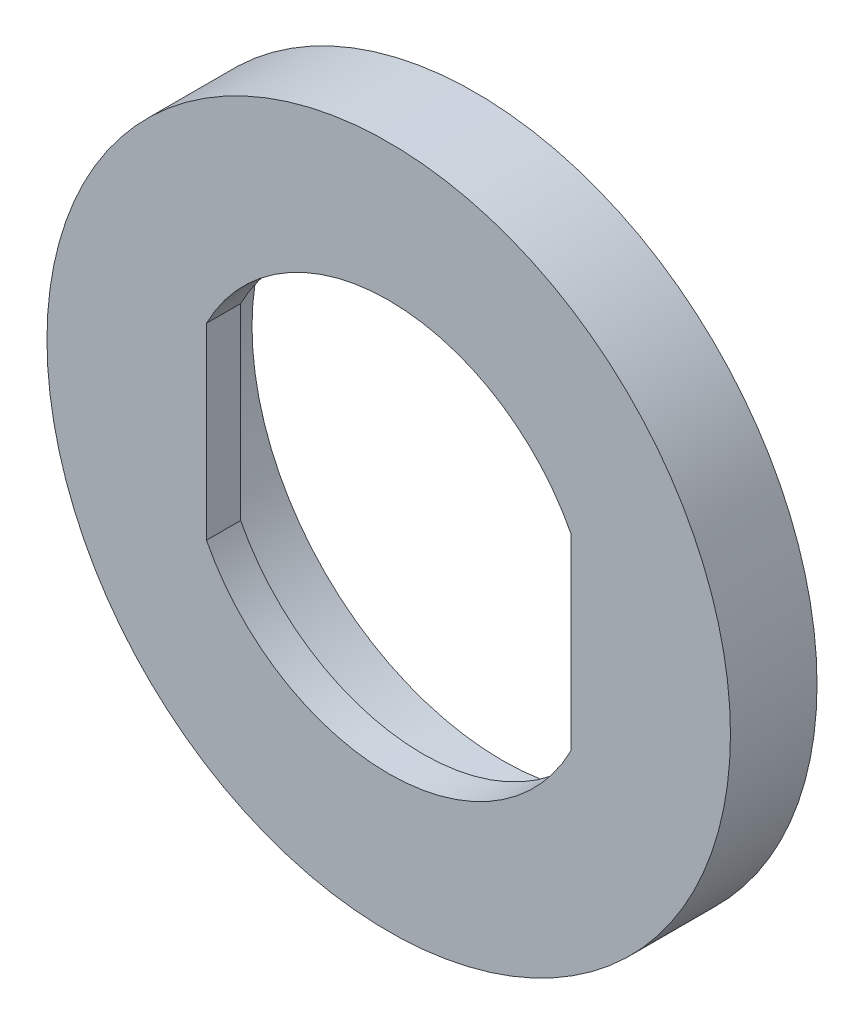
from build123d import *

# Parameters (mm, degrees)
SKETCH_1_R           = 13
SKETCH_1_R_2         = 11
EXTRUDE_1_DEPTH      = 4
EXTRUDE_2_DEPTH      = 1
EXTRUDE_2_DEPTH_BACK = 2.8
SKETCH_2_R           = 15
SKETCH_3_R           = 11
CUT_EXTRUDE_1_DEPTH  = 2.3
CUT_EXTRUDE_2_DEPTH  = 2


with BuildPart() as part:
    # 草图1 → 拉伸1 (new body)
    with BuildSketch(Plane.XY):
        Circle(SKETCH_1_R)
        Circle(SKETCH_1_R_2, mode=Mode.SUBTRACT)
    extrude(amount=EXTRUDE_1_DEPTH)

    # 草图2 → 拉伸2 (add, two sides: drawn at the far end of the back side and taken through both)
    with BuildSketch(Plane.XY.offset(4).offset(-EXTRUDE_2_DEPTH_BACK)):
        Circle(SKETCH_2_R)
    extrude(amount=EXTRUDE_2_DEPTH + EXTRUDE_2_DEPTH_BACK)

    # 草图3 → 切除-拉伸1 (cut)
    with BuildSketch(Plane(origin=(0, 0, 1.2), x_dir=(-1, 0, 0), z_dir=(0, 0, -1))):
        Circle(SKETCH_3_R)
    extrude(amount=-CUT_EXTRUDE_1_DEPTH, mode=Mode.SUBTRACT)

    # 草图4 → 切除-拉伸2 (cut)
    with BuildSketch(Plane(origin=(0, 0, 3.5), x_dir=(-1, 0, 0), z_dir=(0, 0, -1))):
        with BuildLine():
            Line((-8, -4.123105626), (-8, 4.123105626))
            ThreePointArc((-8, 4.123105626), (0, 9), (8, 4.123105626))
            Line((8, 4.123105626), (8, -4.123105626))
            ThreePointArc((8, -4.123105626), (0, -9), (-8, -4.123105626))
        make_face()
    extrude(amount=-CUT_EXTRUDE_2_DEPTH, mode=Mode.SUBTRACT)


solid = part.part
